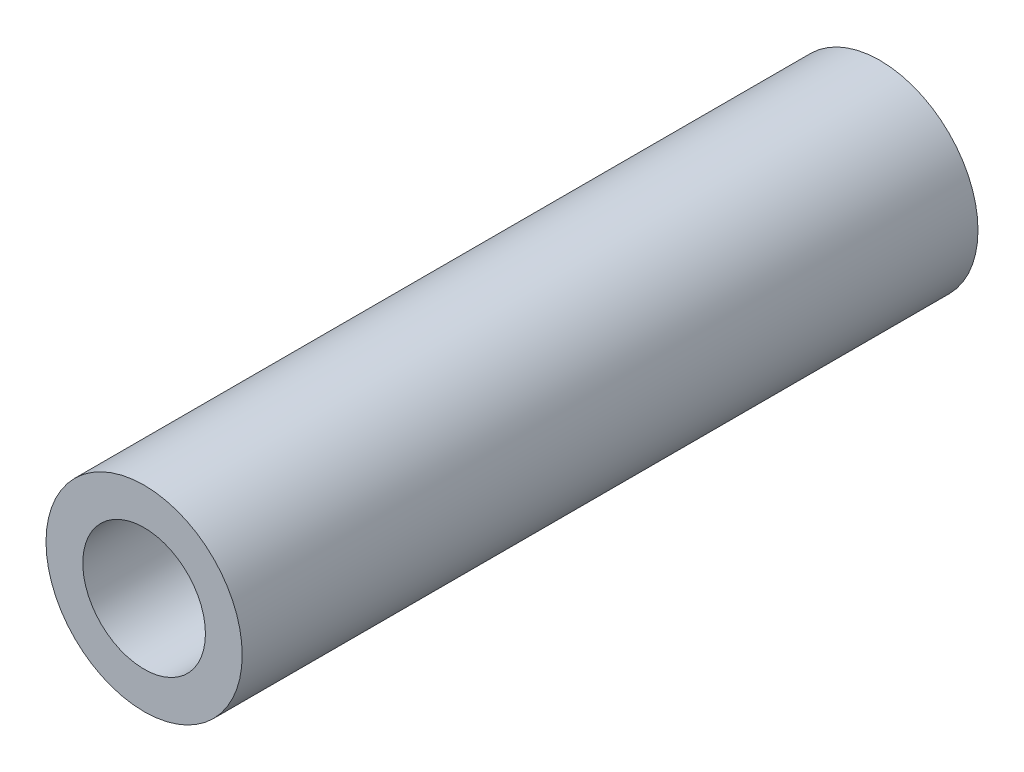
from build123d import *

# Parameters (mm, degrees)
SKETCH1_R           = 4
SKETCH1_R_2         = 2.5
BOSS_EXTRUDE1_DEPTH = 30


with BuildPart() as part:
    # Sketch1 → Boss-Extrude1 (new body)
    with BuildSketch(Plane.XY):
        Circle(SKETCH1_R)
        Circle(SKETCH1_R_2, mode=Mode.SUBTRACT)
    extrude(amount=BOSS_EXTRUDE1_DEPTH)


solid = part.part
